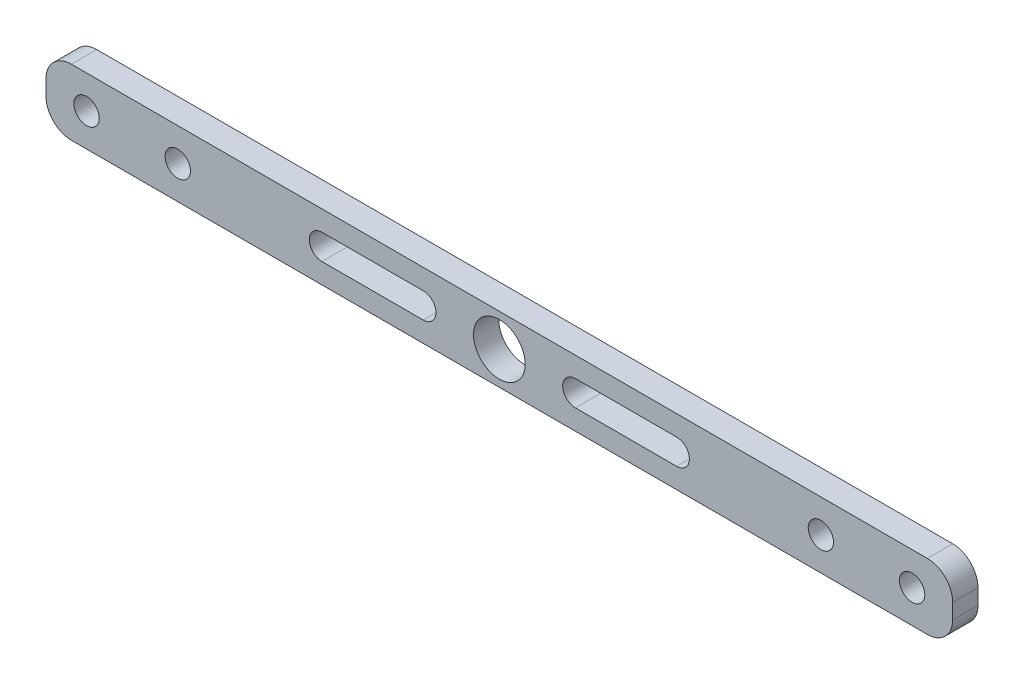
from build123d import *

# Parameters (mm, degrees)
SKETCH1_R           = 5.1
BOSS_EXTRUDE1_DEPTH = 5
SKETCH2_R           = 2.5
CUT_EXTRUDE1_DEPTH  = 35


with BuildPart() as part:
    # Sketch1 → Boss-Extrude1 (new body)
    with BuildSketch(Plane.XY):
        with BuildLine():
            Line((-84.445, 6.5), (84.445, 6.5))
            ThreePointArc((84.445, 6.5), (87.980533906, 5.035533906), (89.445, 1.5))
            Line((89.445, 1.5), (89.445, -1.5))
            ThreePointArc((89.445, -1.5), (87.980533906, -5.035533906), (84.445, -6.5))
            Line((84.445, -6.5), (-84.445, -6.5))
            ThreePointArc((-84.445, -6.5), (-87.980533906, -5.035533906), (-89.445, -1.5))
            Line((-89.445, -1.5), (-89.445, 1.5))
            ThreePointArc((-89.445, 1.5), (-87.980533906, 5.035533906), (-84.445, 6.5))
        make_face()
        Circle(SKETCH1_R, mode=Mode.SUBTRACT)
    extrude(amount=BOSS_EXTRUDE1_DEPTH)

    # Sketch2 → Cut-Extrude1 (cut)
    with BuildSketch(Plane.XY.offset(5)):
        with Locations((-81.445, 0)):
            Circle(SKETCH2_R)
        with Locations((-63.445, 0)):
            Circle(SKETCH2_R)
        with Locations((63.445, 0)):
            Circle(SKETCH2_R)
        with Locations((81.445, 0)):
            Circle(SKETCH2_R)
        with BuildLine():
            Line((15, 2.5), (35, 2.5))
            ThreePointArc((35, 2.5), (37.5, 0), (35, -2.5))
            Line((35, -2.5), (15, -2.5))
            ThreePointArc((15, -2.5), (12.5, 0), (15, 2.5))
        make_face()
        with BuildLine():
            Line((-15, 2.5), (-35, 2.5))
            ThreePointArc((-35, 2.5), (-37.5, 0), (-35, -2.5))
            Line((-35, -2.5), (-15, -2.5))
            ThreePointArc((-15, -2.5), (-12.5, 0), (-15, 2.5))
        make_face()
    extrude(amount=-CUT_EXTRUDE1_DEPTH, mode=Mode.SUBTRACT)


solid = part.part
